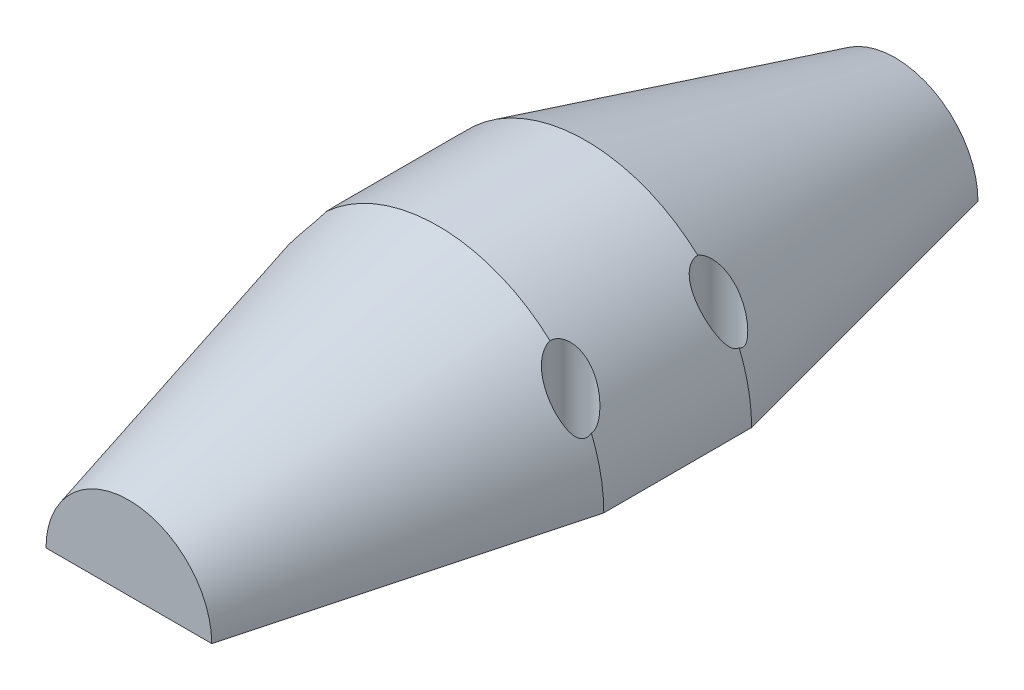
from build123d import *

# Parameters (mm, degrees)
SKETCH1_R           = 12.7
BOSS_EXTRUDE1_DEPTH = 58.7248
CHAMFER3_SIZE       = 6.35
CHAMFER3_SIZE2      = 23.698522628
CHAMFER4_SIZE       = 6.35
CHAMFER4_SIZE2      = 23.698522628
CUT_EXTRUDE1_DEPTH  = 58.7248
SKETCH3_R           = 1.5875
CUT_EXTRUDE2_DEPTH  = 62.409951433


with BuildPart() as part:
    # Sketch1 → Boss-Extrude1 (new body)
    with BuildSketch(Plane.XY):
        Circle(SKETCH1_R)
    extrude(amount=-BOSS_EXTRUDE1_DEPTH)

    # Chamfer3
    chamfer3_edges = [part.edges().sort_by_distance(p)[0] for p in [
        (-12.7, 0, -58.7248),
    ]]
    chamfer3_side = [part.faces().sort_by_distance(p)[0] for p in [
        (0, 0, -58.7248),
    ]]
    chamfer(chamfer3_edges, length=CHAMFER3_SIZE, length2=CHAMFER3_SIZE2, reference=chamfer3_side[0])

    # Chamfer4
    chamfer4_edges = [part.edges().sort_by_distance(p)[0] for p in [
        (-12.7, 0, 0),
    ]]
    chamfer4_side = [part.faces().sort_by_distance(p)[0] for p in [
        (0, 0, 0),
    ]]
    chamfer(chamfer4_edges, length=CHAMFER4_SIZE, length2=CHAMFER4_SIZE2, reference=chamfer4_side[0])

    # Sketch2 → Cut-Extrude1 (cut)
    with BuildSketch(Plane(origin=(0, 0, 0), x_dir=(1, 0, 0), z_dir=(0, 1, 0))):
        Polygon((-6.35, 0), (-12.7, 23.698522628), (-12.7, 35.026277372), (-6.35, 58.7248), (6.35, 58.7248), (12.7, 35.026277372), (12.7, 23.698522628), (6.35, 0), align=None)
    extrude(amount=-CUT_EXTRUDE1_DEPTH, mode=Mode.SUBTRACT)

    # Sketch3 → Cut-Extrude2 (cut, through all)
    with BuildSketch(Plane(origin=(0, 0, 0), x_dir=(1, 0, 0), z_dir=(0, 1, 0))):
        with Locations(Location((-10.16, 35.026277372, 0), (0, 0, 179.999999983))):
            Circle(SKETCH3_R)
        with Locations(Location((10.16, 35.026277372, 0), (0, 0, 90))):
            Circle(SKETCH3_R)
        with Locations((10.16, 23.698522628)):
            Circle(SKETCH3_R)
        with Locations(Location((-10.16, 23.698522628, 0), (0, 0, 90))):
            Circle(SKETCH3_R)
    extrude(amount=CUT_EXTRUDE2_DEPTH, mode=Mode.SUBTRACT)


solid = part.part
